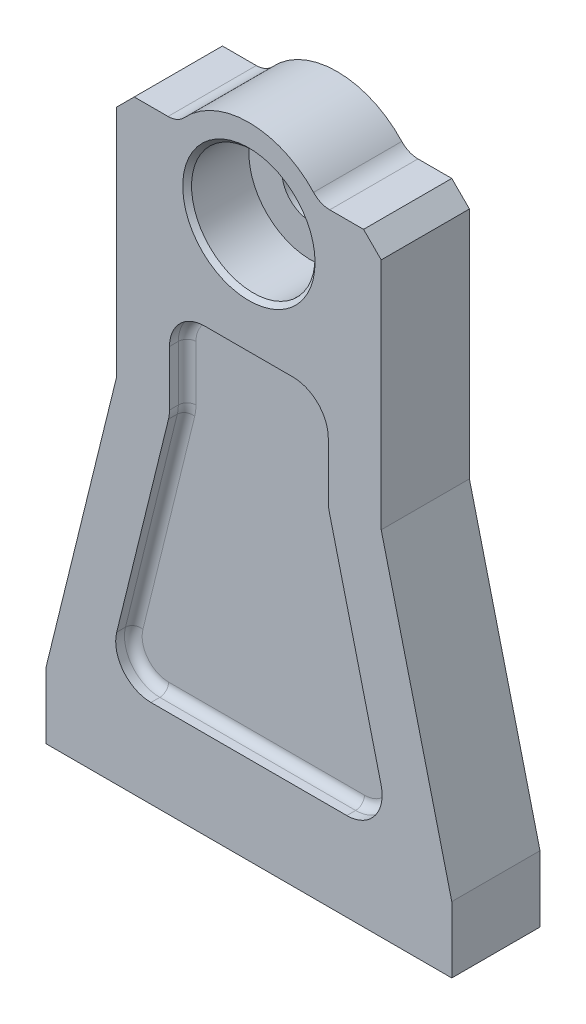
from build123d import *

# Parameters (mm, degrees)
SKETCH1_R                         = 6.5
BOSS_EXTRUDE1_DEPTH               = 10
SKETCH2_R                         = 14
CUT_EXTRUDE1_DEPTH                = 14
CHAMFER1_SIZE                     = 1
CHAMFER2_SIZE                     = 4
FILLET1_R                         = 5
CUT_EXTRUDE2_DEPTH                = 4
FILLET2_R                         = 2
FILLET2_OF_MIRROR1_R              = 2
M10X1_25_TAPPED_HOLE2_D           = 8.8
M10X1_25_TAPPED_HOLE2_DEPTH       = 20
M10X1_25_TAPPED_HOLE2_CSINK_D     = 10.05
M10X1_25_TAPPED_HOLE2_CSINK_ANGLE = 90
M10X1_25_TAPPED_HOLE2_TIP         = 2.643786724


with BuildPart() as part:
    # Sketch1 → Boss-Extrude1 (new, symmetric)
    with BuildSketch(Plane.XY):
        with BuildLine():
            Line((-46, 0), (46, 0))
            Line((46, 0), (46, 15))
            Line((46, 15), (30, 80))
            Line((30, 80), (30, 137))
            Line((30, 137), (16, 137))
            ThreePointArc((16, 137), (0, 145), (-16, 137))
            Line((-16, 137), (-30, 137))
            Line((-30, 137), (-30, 80))
            Line((-30, 80), (-46, 15))
            Line((-46, 15), (-46, 0))
        make_face()
        with Locations((0, 125)):
            Circle(SKETCH1_R, mode=Mode.SUBTRACT)
    extrude(amount=BOSS_EXTRUDE1_DEPTH, both=True)

    # Sketch2 → Cut-Extrude1 (cut)
    with BuildSketch(Plane.XY.offset(10)):
        with Locations((0, 125)):
            Circle(SKETCH2_R)
    extrude(amount=-CUT_EXTRUDE1_DEPTH, mode=Mode.SUBTRACT)

    # Chamfer1
    chamfer1_edges = [part.edges().sort_by_distance(p)[0] for p in [
        (-14, 125, 10),
    ]]
    chamfer(chamfer1_edges, length=CHAMFER1_SIZE)

    # Chamfer2
    chamfer2_edges = [part.edges().sort_by_distance(p)[0] for p in [
        (-30, 137, 0),
        (30, 137, 0),
    ]]
    chamfer(chamfer2_edges, length=CHAMFER2_SIZE)

    # Fillet1
    fillet1_edges = [part.edges().sort_by_distance(p)[0] for p in [
        (-16, 137, 0),
        (16, 137, 0),
    ]]
    fillet(fillet1_edges, radius=FILLET1_R)

    # Sketch3 → Cut-Extrude2 (cut)
    with BuildSketch(Plane.XY.offset(10)):
        with BuildLine():
            Line((-18, 92), (-18, 79.514932029))
            ThreePointArc((-18, 79.514932029), (-18.058181812, 78.55185162), (-18.231880969, 77.602779652))
            Line((-18.231880969, 77.602779652), (-29.971112298, 29.912152377))
            ThreePointArc((-29.971112298, 29.912152377), (-28.49970745, 23.065287193), (-22.202993266, 20))
            Line((-22.202993266, 20), (22.202993266, 20))
            ThreePointArc((22.202993266, 20), (28.49970745, 23.065287193), (29.971112298, 29.912152377))
            Line((29.971112298, 29.912152377), (18.231880969, 77.602779652))
            ThreePointArc((18.231880969, 77.602779652), (18.058181812, 78.55185162), (18, 79.514932029))
            Line((18, 79.514932029), (18, 92))
            ThreePointArc((18, 92), (15.656854249, 97.656854249), (10, 100))
            Line((10, 100), (-10, 100))
            ThreePointArc((-10, 100), (-15.656854249, 97.656854249), (-18, 92))
        make_face()
    cut_extrude2 = extrude(amount=-CUT_EXTRUDE2_DEPTH, mode=Mode.SUBTRACT)

    # Fillet2
    fillet2_edges = [part.edges().sort_by_distance(p)[0] for p in [
        (18.058181812, 78.55185162, 6),
        (24.101496633, 53.757466014, 6),
        (28.49970745, 23.065287193, 6),
        (0, 20, 6),
        (-28.49970745, 23.065287193, 6),
        (-24.101496633, 53.757466014, 6),
        (-18.058181812, 78.55185162, 6),
        (-18, 85.757466014, 6),
        (-15.656854249, 97.656854249, 6),
        (0, 100, 6),
        (15.656854249, 97.656854249, 6),
        (18, 85.757466014, 6),
    ]]
    fillet(fillet2_edges, radius=FILLET2_R)

    # Mirror1: Cut-Extrude2 across plane
    add(cut_extrude2.mirror(Plane.XY), mode=Mode.SUBTRACT)

    # Fillet2 of Mirror1
    fillet2_of_mirror1_edges = [part.edges().sort_by_distance(p)[0] for p in [
        (18.058181812, 78.55185162, -6),
        (24.101496633, 53.757466014, -6),
        (28.49970745, 23.065287193, -6),
        (0, 20, -6),
        (-28.49970745, 23.065287193, -6),
        (-24.101496633, 53.757466014, -6),
        (-18.058181812, 78.55185162, -6),
        (-18, 85.757466014, -6),
        (-15.656854249, 97.656854249, -6),
        (0, 100, -6),
        (15.656854249, 97.656854249, -6),
        (18, 85.757466014, -6),
    ]]
    fillet(fillet2_of_mirror1_edges, radius=FILLET2_OF_MIRROR1_R)

    # M10x1.25 Tapped Hole2
    with Locations(Plane(origin=(0, 0, 0), x_dir=(-1, 0, 0), z_dir=(0, -1, 0))):
        with Locations((-30, 0), (30, 0)):
            CounterSinkHole(M10X1_25_TAPPED_HOLE2_D / 2, M10X1_25_TAPPED_HOLE2_CSINK_D / 2, depth=M10X1_25_TAPPED_HOLE2_DEPTH, counter_sink_angle=M10X1_25_TAPPED_HOLE2_CSINK_ANGLE)
            with Locations((0, 0, -(M10X1_25_TAPPED_HOLE2_DEPTH + M10X1_25_TAPPED_HOLE2_TIP / 2))):  # 118° drill point
                Cone(0, M10X1_25_TAPPED_HOLE2_D / 2, M10X1_25_TAPPED_HOLE2_TIP, mode=Mode.SUBTRACT)


solid = part.part
